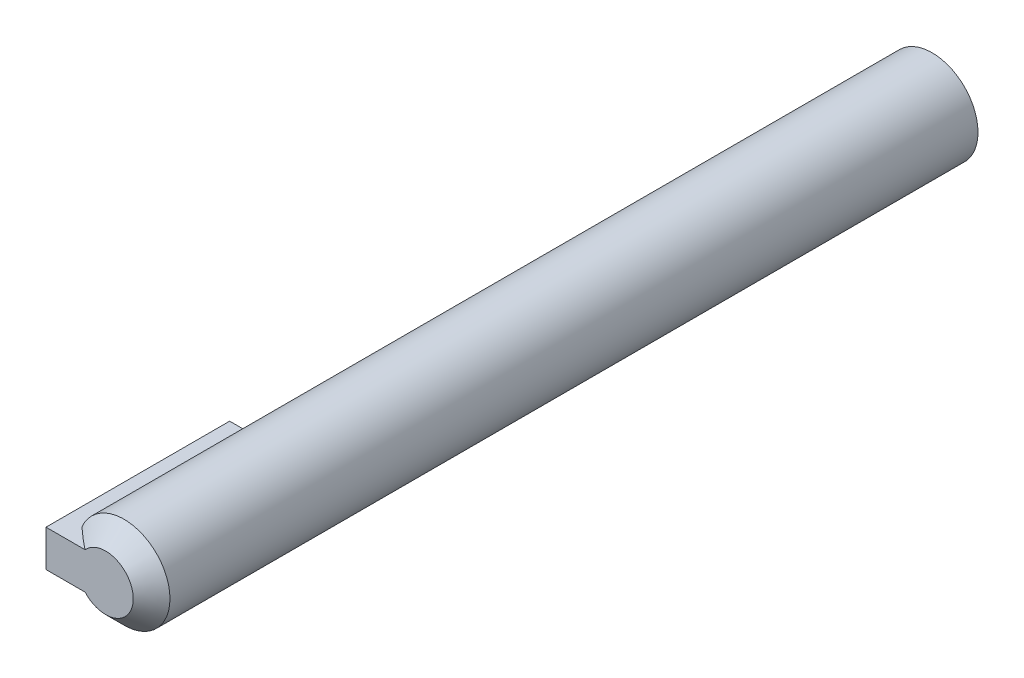
from build123d import *

# Parameters (mm, degrees)
SKETCH_1_R      = 5
EXTRUDE_1_DEPTH = 90
SKETCH_2_W      = 6.5
SKETCH_2_H      = 4
EXTRUDE_2_DEPTH = 20
CHAMFER_1_SIZE  = 2


with BuildPart() as part:
    # 草图1 → 凸台-拉伸1 (new body)
    with BuildSketch(Plane.XY):
        with Locations(Location((0, 0, 0), (0, 0, 180))):
            Circle(SKETCH_1_R)
    extrude(amount=EXTRUDE_1_DEPTH)

    # 草图2 → 凸台-拉伸2 (add)
    with BuildSketch(Plane.XY.offset(90)):
        with Locations((-3.25, 0)):
            Rectangle(SKETCH_2_W, SKETCH_2_H)
    extrude(amount=-EXTRUDE_2_DEPTH)

    # 倒角1
    chamfer_1_edges = [part.edges().sort_by_distance(p)[0] for p in [
        (5, 0, 90),
    ]]
    chamfer(chamfer_1_edges, length=CHAMFER_1_SIZE)


solid = part.part
